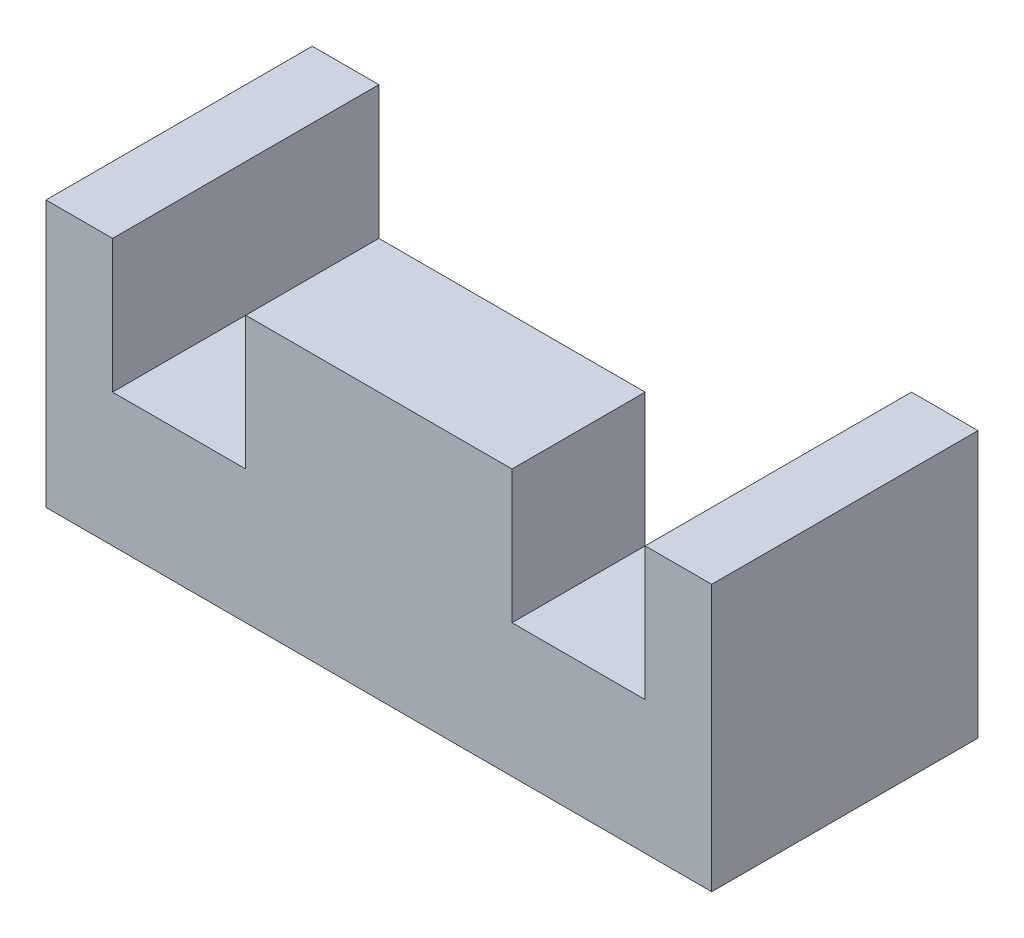
from build123d import *

# Parameters (mm, degrees)
EXTRUDE_1_DEPTH     = 20
SKETCH_2_W          = 20
SKETCH_2_H          = 20
CUT_EXTRUDE_1_DEPTH = 10


with BuildPart() as part:
    # 草圖1 → 填料-伸長1 (new body)
    with BuildSketch(Plane.XY):
        Polygon((-20, 10), (-25, 10), (-25, -10), (25, -10), (25, 10), (20, 10), (20, 0), (10, 0), (10, 10), (-10, 10), (-10, 0), (-20, 0), align=None)
    extrude(amount=EXTRUDE_1_DEPTH)

    # 草圖2 → 除料-伸長1 (cut)
    with BuildSketch(Plane(origin=(0, 0, 0), x_dir=(-1, 0, 0), z_dir=(0, 0, -1))):
        Rectangle(SKETCH_2_W, SKETCH_2_H)
    extrude(amount=-CUT_EXTRUDE_1_DEPTH, mode=Mode.SUBTRACT)


solid = part.part
